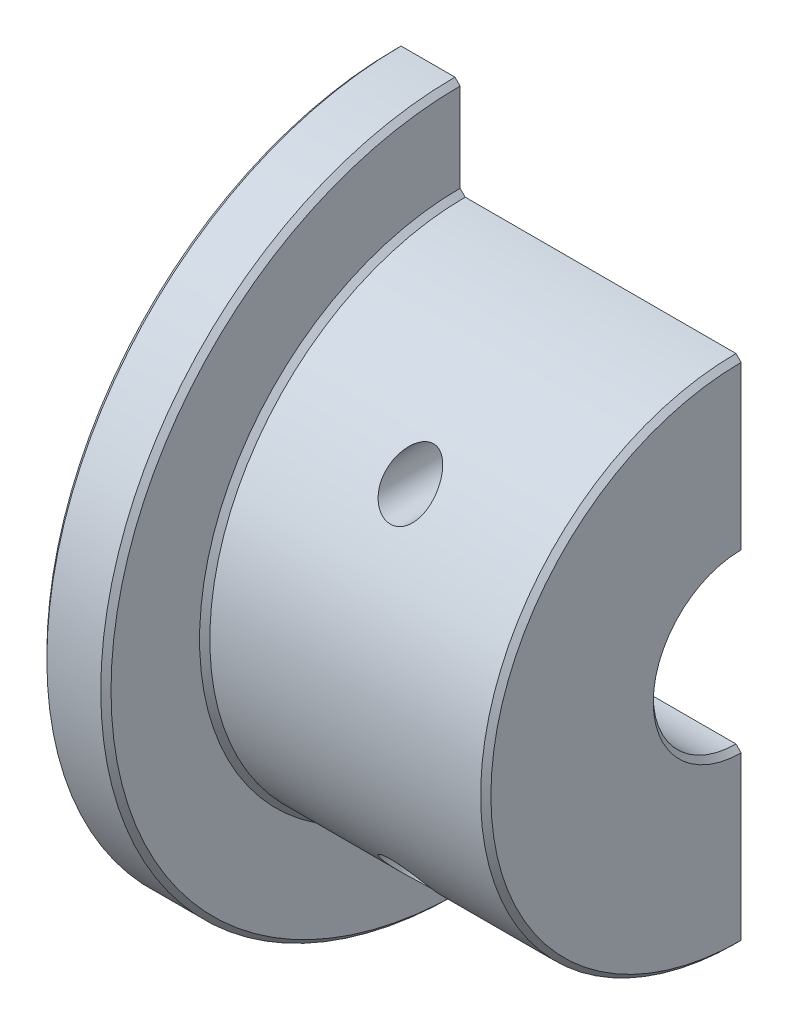
from build123d import *

# Parameters (mm, degrees)
SKETCH1_R           = 12.6365
BOSS_EXTRUDE1_DEPTH = 21.844
SKETCH2_R           = 17.526
BOSS_EXTRUDE2_DEPTH = 3.175
CHAMFER1_SIZE       = 0.254
SKETCH3_R           = 4.09575
CUT_EXTRUDE1_DEPTH  = 34.037579936
CHAMFER2_SIZE       = 0.254
SKETCH4_R           = 1.984375
CUT_EXTRUDE2_DEPTH  = 22.606
SKETCH5_R           = 12.8905
CUT_EXTRUDE3_DEPTH  = 4.7625
SKETCH6_W           = 26.198256486
SKETCH6_H           = 39.009491802
CUT_EXTRUDE4_DEPTH  = 41.783
SKETCH7_R           = 1.190625
CUT_EXTRUDE5_DEPTH  = 12.7
BOSS_EXTRUDE3_DEPTH = 1.524


with BuildPart() as part:
    # Sketch1 → Boss-Extrude1 (new body)
    with BuildSketch(Plane(origin=(0, 0, 0), x_dir=(0, 0, -1), z_dir=(1, 0, 0))):
        Circle(SKETCH1_R)
    extrude(amount=BOSS_EXTRUDE1_DEPTH)

    # Sketch2 → Boss-Extrude2 (add)
    with BuildSketch(Plane(origin=(7.9375, 0, 0), x_dir=(0, 0, -1), z_dir=(1, 0, 0))):
        Circle(SKETCH2_R)
    extrude(amount=-BOSS_EXTRUDE2_DEPTH)

    # Chamfer1
    chamfer1_edges = [part.edges().sort_by_distance(p)[0] for p in [
        (0, 0, 12.6365),
        (21.844, 0, 12.6365),
        (4.7625, 0, 12.6365),
        (7.9375, 0, 12.6365),
        (4.7625, 0, 17.526),
        (7.9375, 0, 17.526),
    ]]
    chamfer(chamfer1_edges, length=CHAMFER1_SIZE)

    # Sketch3 → Cut-Extrude1 (cut, through all)
    with BuildSketch(Plane(origin=(21.844, 0, 0), x_dir=(0, 0, -1), z_dir=(1, 0, 0))):
        Circle(SKETCH3_R)
    extrude(amount=-CUT_EXTRUDE1_DEPTH, mode=Mode.SUBTRACT)

    # Chamfer2
    chamfer2_edges = [part.edges().sort_by_distance(p)[0] for p in [
        (0, 0, 4.09575),
        (21.844, 0, 4.09575),
    ]]
    chamfer(chamfer2_edges, length=CHAMFER2_SIZE)

    # Sketch4 → Cut-Extrude2 (cut)
    with BuildSketch(Plane.XY):
        with Locations((14.89075, 0)):
            Circle(SKETCH4_R)
    extrude(amount=-CUT_EXTRUDE2_DEPTH, mode=Mode.SUBTRACT)

    # Sketch5 → Cut-Extrude3 (cut)
    with BuildSketch(Plane.ZY):
        Circle(SKETCH5_R)
    extrude(amount=-CUT_EXTRUDE3_DEPTH, mode=Mode.SUBTRACT)

    # Sketch6 → Cut-Extrude4 (cut)
    with BuildSketch(Plane.XY):
        with Locations((13.991232321, 0)):
            Rectangle(SKETCH6_W, SKETCH6_H)
    extrude(amount=-CUT_EXTRUDE4_DEPTH, mode=Mode.SUBTRACT)

    # Sketch7 → Cut-Extrude5 (cut)
    with BuildSketch(Plane(origin=(0, 0, 0), x_dir=(-1, 0, 0), z_dir=(0, 0, -1))):
        with Locations((-14.89075, 8.366125)):
            Circle(SKETCH7_R)
    cut_extrude5 = extrude(amount=-CUT_EXTRUDE5_DEPTH, mode=Mode.SUBTRACT)

    # Mirror1: Cut-Extrude5 across plane
    add(cut_extrude5.mirror(Plane.ZX), mode=Mode.SUBTRACT)

    # Sketch8 → Boss-Extrude3 (add)
    with BuildSketch(Plane.ZY.offset(-4.7625)):
        with BuildLine():
            Line((0, -10.16), (0, -6.604))
            ThreePointArc((0, -6.604), (6.604, 0), (0, 6.604))
            Line((0, 6.604), (0, 10.16))
            ThreePointArc((0, 10.16), (10.16, 0), (0, -10.16))
        make_face()
    extrude(amount=BOSS_EXTRUDE3_DEPTH)


solid = part.part
